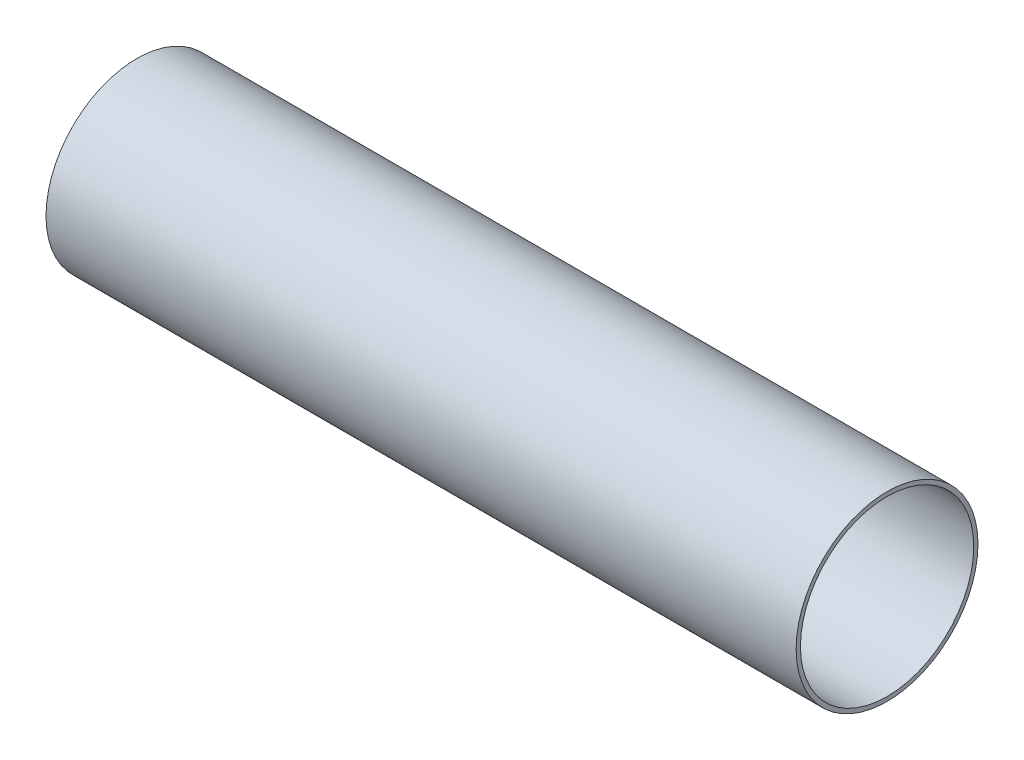
from build123d import *

# Parameters (mm, degrees)
SKETCH1_R           = 101.6
SKETCH1_R_2         = 96.8375
BOSS_EXTRUDE1_DEPTH = 838.2


with BuildPart() as part:
    # Sketch1 → Boss-Extrude1 (new body)
    with BuildSketch(Plane(origin=(0, 0, 0), x_dir=(0, 0, -1), z_dir=(1, 0, 0))):
        Circle(SKETCH1_R)
        Circle(SKETCH1_R_2, mode=Mode.SUBTRACT)
    extrude(amount=BOSS_EXTRUDE1_DEPTH)


solid = part.part
